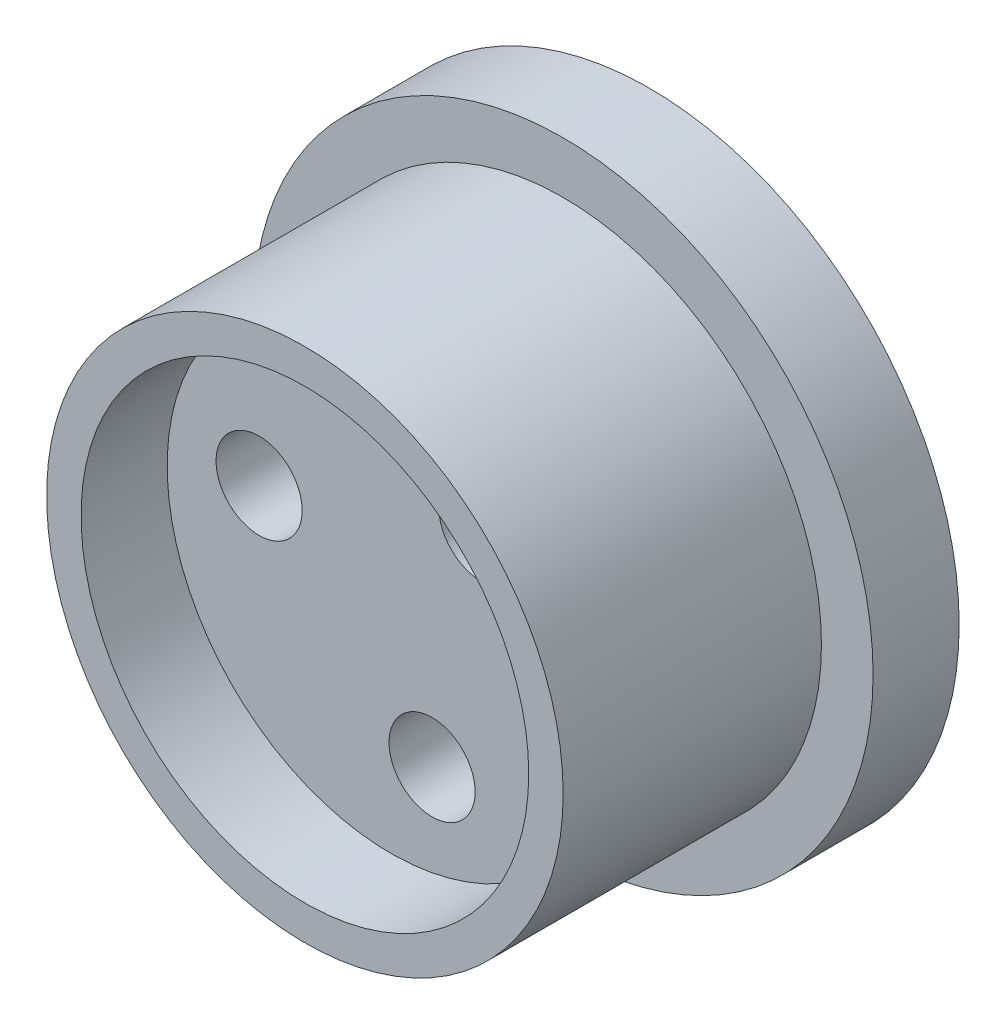
from build123d import *

# Parameters (mm, degrees)
SKETCH1_R           = 18
SKETCH1_R_2         = 15
BOSS_EXTRUDE1_DEPTH = 5
SKETCH1_3_R         = 15
SKETCH1_3_R_2       = 13
BOSS_EXTRUDE2_DEPTH = 20
SKETCH1_4_R         = 13
BOSS_EXTRUDE3_DEPTH = 15
SKETCH2_R           = 2.5
CUT_EXTRUDE1_DEPTH  = 30.546573405


with BuildPart() as part:
    # Sketch1 → Boss-Extrude1 (new body)
    with BuildSketch(Plane.XY):
        Circle(SKETCH1_R)
        Circle(SKETCH1_R_2, mode=Mode.SUBTRACT)
    extrude(amount=BOSS_EXTRUDE1_DEPTH)

    # Sketch1<3> → Boss-Extrude2 (add)
    with BuildSketch(Plane.XY):
        Circle(SKETCH1_3_R)
        Circle(SKETCH1_3_R_2, mode=Mode.SUBTRACT)
    extrude(amount=BOSS_EXTRUDE2_DEPTH)

    # Sketch1<4> → Boss-Extrude3 (add)
    with BuildSketch(Plane.XY):
        Circle(SKETCH1_4_R)
    extrude(amount=BOSS_EXTRUDE3_DEPTH)

    # Sketch2 → Cut-Extrude1 (cut, through all)
    with BuildSketch(Plane.XY.offset(15)):
        with Locations((-7.66, 1.666394077)):
            Circle(SKETCH2_R)
        with Locations((5.273139603, 5.800557555)):
            Circle(SKETCH2_R)
        with Locations((2.386860397, -7.466951631)):
            Circle(SKETCH2_R)
    extrude(amount=-CUT_EXTRUDE1_DEPTH, mode=Mode.SUBTRACT)


solid = part.part
